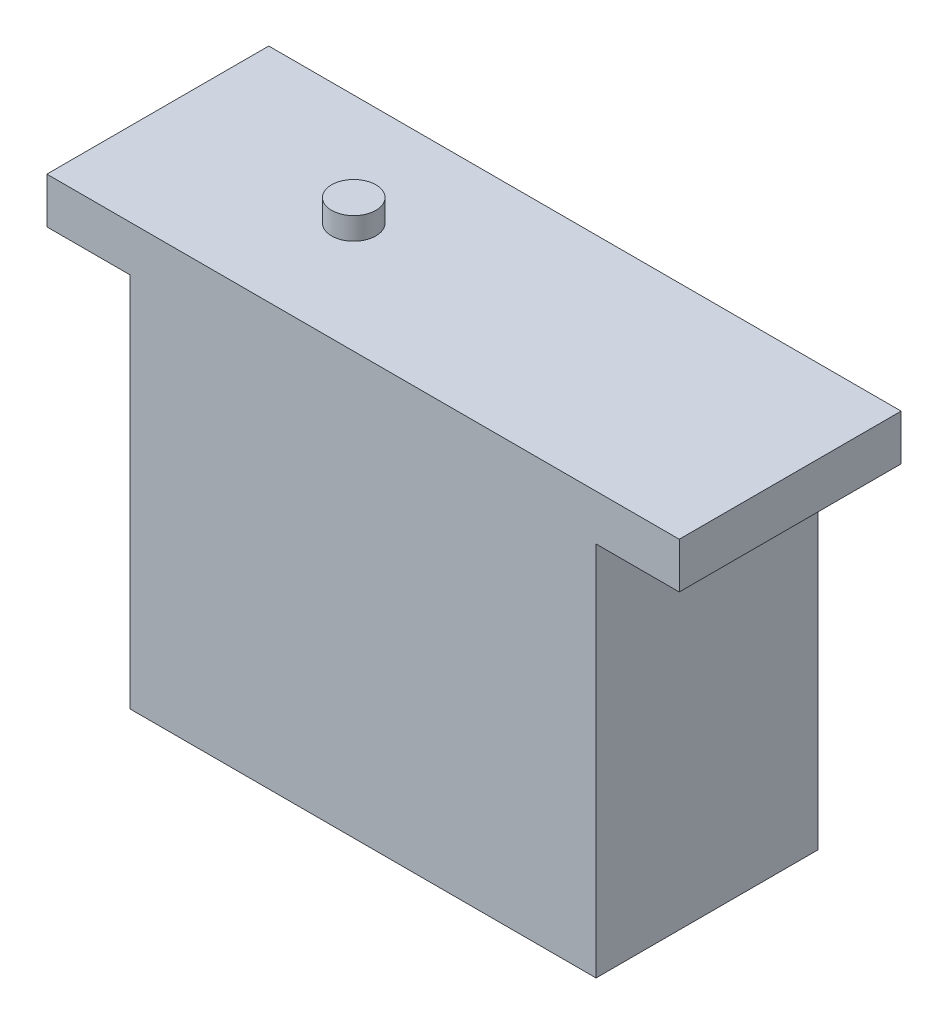
from build123d import *

# Parameters (mm, degrees)
SKETCH1_W           = 42
SKETCH1_H           = 38
BOSS_EXTRUDE1_DEPTH = 20
SKETCH3_R           = 1.995914713
BOSS_EXTRUDE2_DEPTH = 2
SKETCH4_W           = 20
SKETCH4_H           = 4.118584071
BOSS_EXTRUDE3_DEPTH = 7.5


with BuildPart() as part:
    # Sketch1 → Boss-Extrude1 (new body)
    with BuildSketch(Plane.XY):
        Rectangle(SKETCH1_W, SKETCH1_H)
    extrude(amount=BOSS_EXTRUDE1_DEPTH)

    # Sketch3 → Boss-Extrude2 (add)
    with BuildSketch(Plane(origin=(0, 19, 0), x_dir=(1, 0, 0), z_dir=(0, 1, 0))):
        with Locations(Location((-10.84, -10, 0), (0, 0, 270))):
            Circle(SKETCH3_R)
    extrude(amount=BOSS_EXTRUDE2_DEPTH)

    # Sketch4 → Boss-Extrude3 (add)
    with BuildSketch(Plane.ZY.offset(21)):
        with Locations((10, 16.940707964)):
            Rectangle(SKETCH4_W, SKETCH4_H)
    boss_extrude3 = extrude(amount=BOSS_EXTRUDE3_DEPTH)

    # Mirror2: Boss-Extrude3 across plane
    add(boss_extrude3.mirror(Plane(origin=(0, 0, 0), x_dir=(0, 0, 1), z_dir=(1, 0, 0))))


solid = part.part
